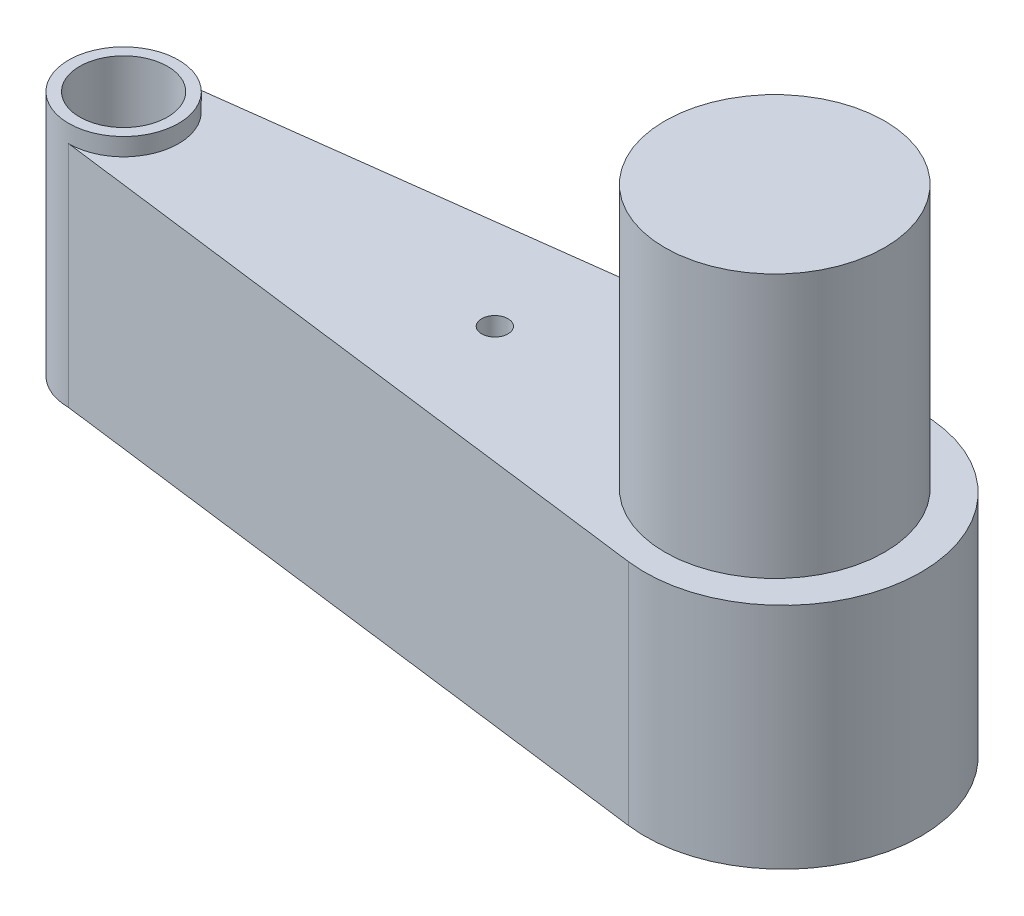
from build123d import *

# Parameters (mm, degrees)
SKETCH1_R           = 5
SKETCH1_R_2         = 1.5
BOSS_EXTRUDE2_DEPTH = 26
SKETCH2_R           = 6.25
BOSS_EXTRUDE3_DEPTH = 2
CUT_EXTRUDE1_START  = -2
SKETCH3_R           = 5
CUT_EXTRUDE1_DEPTH  = 2
SKETCH5_R           = 12.5
BOSS_EXTRUDE4_DEPTH = 30


with BuildPart() as part:
    # Sketch1 → Boss-Extrude2 (new body)
    with BuildSketch(Plane(origin=(0, 0, 0), x_dir=(1, 0, 0), z_dir=(0, 1, 0))):
        with BuildLine():
            Line((-19.568980619, 0), (53.439105934, 9.332584612))
            ThreePointArc((53.439105934, 9.332584612), (71.14040073, -6.25), (53.439105934, -21.832584612))
            Line((53.439105934, -21.832584612), (-19.568980619, -12.5))
            ThreePointArc((-19.568980619, -12.5), (-25.818980619, -6.25), (-19.568980619, 0))
        make_face()
        with Locations(Location((-19.568980619, -6.25, 0), (0, 0, 90))):
            Circle(SKETCH1_R, mode=Mode.SUBTRACT)
        with Locations(Location((22.660710056, -6.25, 0), (0, 0, 90))):
            Circle(SKETCH1_R_2, mode=Mode.SUBTRACT)
    extrude(amount=BOSS_EXTRUDE2_DEPTH)

    # Sketch2 → Boss-Extrude3 (add)
    with BuildSketch(Plane(origin=(0, 26, 0), x_dir=(1, 0, 0), z_dir=(0, 1, 0))):
        with Locations(Location((-19.568980619, -6.25, 0), (0, 0, 270))):
            Circle(SKETCH2_R)
    extrude(amount=BOSS_EXTRUDE3_DEPTH)

    # Sketch3 → Cut-Extrude1 (cut)
    with BuildSketch(Plane(origin=(0, 28, 0), x_dir=(1, 0, 0), z_dir=(0, 1, 0)).offset(CUT_EXTRUDE1_START)):
        with Locations(Location((-19.568980619, -6.25, 0), (0, 0, 90))):
            Circle(SKETCH3_R)
    extrude(amount=CUT_EXTRUDE1_DEPTH, mode=Mode.SUBTRACT)

    # Sketch5 → Boss-Extrude4 (add)
    with BuildSketch(Plane(origin=(0, 26, 0), x_dir=(1, 0, 0), z_dir=(0, 1, 0))):
        with Locations(Location((54.591675649, -6.337344707, 0), (0, 0, 90))):
            Circle(SKETCH5_R)
    extrude(amount=BOSS_EXTRUDE4_DEPTH)


solid = part.part
